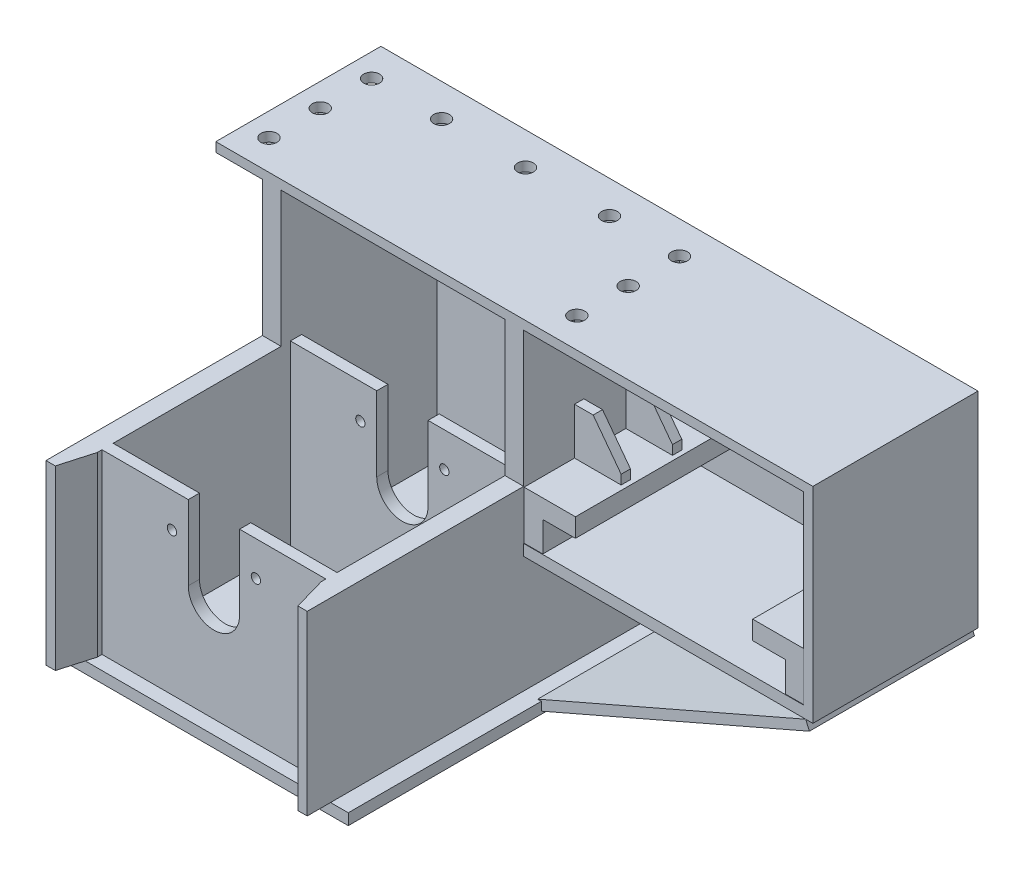
from build123d import *

# Parameters (mm, degrees)
SKETCH_1_W             = 640
SKETCH_1_H             = 177
SKETCH_1_R             = 8.5
EXTRUDE_1_DEPTH        = 10
SKETCH_2_W             = 20
SKETCH_2_H             = 177
EXTRUDE_2_DEPTH        = 335
SKETCH_3_W             = 20
SKETCH_3_H             = 190
EXTRUDE_3_DEPTH        = 232
CUT_EXTRUDE_1_DEPTH    = 764.183464181
SKETCH_5_W             = 240
SKETCH_5_H             = 10
EXTRUDE_4_DEPTH        = 335
SKETCH_6_R             = 35
CUT_EXTRUDE_2_DEPTH    = 10
SKETCH_7_W             = 10
SKETCH_7_H             = 335
EXTRUDE_5_DEPTH        = 300
SKETCH_8_R             = 6
CUT_EXTRUDE_3_DEPTH    = 10
SKETCH_9_W             = 177
SKETCH_9_H             = 210
EXTRUDE_6_DEPTH        = 10
EXTRUDE_7_DEPTH        = 177
SKETCH_12_R            = 5
EXTRUDE_8_DEPTH        = 12
PATTERN_LINEAR_2_COUNT = 2
PATTERN_LINEAR_2_PITCH = 202
SKETCH_14_W            = 300
SKETCH_14_H            = 12
EXTRUDE_9_DEPTH        = 167
SKETCH_15_W            = 166
SKETCH_15_H            = 32
EXTRUDE_10_DEPTH       = 20
SKETCH_16_W            = 55
SKETCH_16_H            = 20
EXTRUDE_11_DEPTH       = 166
EXTRUDE_12_DEPTH       = 166
SKETCH_18_W            = 300
SKETCH_18_H            = 47
SKETCH_18_H_2          = 45
SKETCH_18_H_3          = 54
CUT_EXTRUDE_4_DEPTH    = 50
EXTRUDE_13_DEPTH       = 10
PATTERN_LINEAR_1_COUNT = 2
PATTERN_LINEAR_1_PITCH = 55
SKETCH_21_W            = 313.989613953
SKETCH_21_H            = 384
EXTRUDE_18_DEPTH       = 12
SKETCH_22_W            = 640
SKETCH_22_H            = 409
CUT_EXTRUDE_5_DEPTH    = 769.682639325


with BuildPart() as part:
    # 草图1 → 凸台-拉伸1 (new body)
    with BuildSketch(Plane(origin=(0, 0, 0), x_dir=(1, 0, 0), z_dir=(0, 1, 0))):
        with Locations((320, 88.5)):
            Rectangle(SKETCH_1_W, SKETCH_1_H)
        with Locations(Location((615, 142, 0), (0, 0, 270))):
            Circle(SKETCH_1_R, mode=Mode.SUBTRACT)
        with Locations(Location((615, 87, 0), (0, 0, 270))):
            Circle(SKETCH_1_R, mode=Mode.SUBTRACT)
        with Locations(Location((615, 32, 0), (0, 0, 270))):
            Circle(SKETCH_1_R, mode=Mode.SUBTRACT)
        with Locations(Location((540, 142, 0), (0, 0, 270))):
            Circle(SKETCH_1_R, mode=Mode.SUBTRACT)
        with Locations(Location((450, 142, 0), (0, 0, 270))):
            Circle(SKETCH_1_R, mode=Mode.SUBTRACT)
        with Locations(Location((360, 142, 0), (0, 0, 270))):
            Circle(SKETCH_1_R, mode=Mode.SUBTRACT)
        with Locations(Location((285, 142, 0), (0, 0, 270))):
            Circle(SKETCH_1_R, mode=Mode.SUBTRACT)
        with Locations(Location((285, 32, 0), (0, 0, 270))):
            Circle(SKETCH_1_R, mode=Mode.SUBTRACT)
        with Locations(Location((285, 87, 0), (0, 0, 270))):
            Circle(SKETCH_1_R, mode=Mode.SUBTRACT)
    extrude(amount=EXTRUDE_1_DEPTH)

    # 草图2 → 凸台-拉伸2 (add)
    with BuildSketch(Plane.XZ):
        with Locations((580, -88.5)):
            Rectangle(SKETCH_2_W, SKETCH_2_H)
        with Locations((320, -88.5)):
            Rectangle(SKETCH_2_W, SKETCH_2_H)
    extrude(amount=EXTRUDE_2_DEPTH)

    # 草图3 → 凸台-拉伸3 (add)
    with BuildSketch(Plane.XY):
        with Locations((580, -240)):
            Rectangle(SKETCH_3_W, SKETCH_3_H)
        with Locations((320, -240)):
            Rectangle(SKETCH_3_W, SKETCH_3_H)
    extrude(amount=EXTRUDE_3_DEPTH)

    # 草图4 → 切除-拉伸1 (cut, through all)
    with BuildSketch(Plane.XZ.offset(335)):
        Polygon((330, 232), (320, 232), (330, 197), align=None)
        Polygon((570, 232), (580, 232), (570, 197), align=None)
    extrude(amount=-CUT_EXTRUDE_1_DEPTH, mode=Mode.SUBTRACT)

    # 草图5 → 凸台-拉伸4 (add)
    with BuildSketch(Plane(origin=(0, 0, 0), x_dir=(-1, 0, 0), z_dir=(0, -1, 0))):
        with Locations((-450, 172)):
            Rectangle(SKETCH_5_W, SKETCH_5_H)
    extrude(amount=EXTRUDE_4_DEPTH)

    # 草图6 → 切除-拉伸2 (cut)
    with BuildSketch(Plane(origin=(0, 0, -177), x_dir=(-1, 0, 0), z_dir=(0, 0, -1))):
        with Locations((-450, -225)):
            Circle(SKETCH_6_R)
    extrude(amount=-CUT_EXTRUDE_2_DEPTH, mode=Mode.SUBTRACT)

    # 草图7 → 凸台-拉伸5 (add)
    with BuildSketch(Plane.ZY.offset(-310)):
        with Locations((-172, -167.5)):
            Rectangle(SKETCH_7_W, SKETCH_7_H)
    extrude(amount=EXTRUDE_5_DEPTH)

    # 草图8 → 切除-拉伸3 (cut)
    with BuildSketch(Plane(origin=(0, 0, -177), x_dir=(-1, 0, 0), z_dir=(0, 0, -1))):
        with Locations((-217, -76)):
            Circle(SKETCH_8_R)
        with Locations((-103, -76)):
            Circle(SKETCH_8_R)
        with Locations((-217, -119)):
            Circle(SKETCH_8_R)
        with Locations((-103, -119)):
            Circle(SKETCH_8_R)
        Polygon((-10, -211), (-295, -335), (-10, -335), align=None)
    extrude(amount=-CUT_EXTRUDE_3_DEPTH, mode=Mode.SUBTRACT)

    # 草图9 → 凸台-拉伸6 (add)
    with BuildSketch(Plane.ZY.offset(-10)):
        with Locations((-88.5, -105)):
            Rectangle(SKETCH_9_W, SKETCH_9_H)
    extrude(amount=EXTRUDE_6_DEPTH)

    # 草图12 → 凸台-拉伸8 (add)
    with BuildSketch(Plane.XY.offset(180)):
        with BuildLine():
            Line((330, -335), (570, -335))
            Line((570, -335), (570, -145))
            Line((570, -145), (477.5, -145))
            Line((477.5, -145), (477.5, -225))
            ThreePointArc((477.5, -225), (450, -252.5), (422.5, -225))
            Line((422.5, -225), (422.5, -145))
            Line((422.5, -145), (330, -145))
            Line((330, -145), (330, -335))
        make_face()
        with Locations((405, -182)):
            Circle(SKETCH_12_R, mode=Mode.SUBTRACT)
        with Locations((495, -182)):
            Circle(SKETCH_12_R, mode=Mode.SUBTRACT)
    extrude_8 = extrude(amount=EXTRUDE_8_DEPTH)

    # 阵列(线性)2: 凸台-拉伸8 ×2
    with Locations(*[(0, 0, -i * PATTERN_LINEAR_2_PITCH) for i in range(1, PATTERN_LINEAR_2_COUNT)]):
        add(extrude_8)

    # 草图14 → 凸台-拉伸9 (add)
    with BuildSketch(Plane.XY.offset(-167)):
        with Locations((160, -204)):
            Rectangle(SKETCH_14_W, SKETCH_14_H)
    extrude(amount=EXTRUDE_9_DEPTH)

    # 草图15 → 凸台-拉伸10 (add)
    with BuildSketch(Plane(origin=(10, 0, 0), x_dir=(0, 0, -1), z_dir=(1, 0, 0))):
        with Locations((83.5, -182)):
            Rectangle(SKETCH_15_W, SKETCH_15_H)
    extrude(amount=EXTRUDE_10_DEPTH)

    # 草图16 → 凸台-拉伸11 (add)
    with BuildSketch(Plane.XY.offset(-0.5)):
        Polygon((310, -146), (310, -198), (290, -198), (290, -166), (255, -166), (255, -146), align=None)
        with Locations((37.5, -156)):
            Rectangle(SKETCH_16_W, SKETCH_16_H)
    extrude(amount=-EXTRUDE_11_DEPTH)

    # 草图17 → 凸台-拉伸12 (add)
    with BuildSketch(Plane.XY.offset(-0.5)):
        Polygon((10, -146), (60, -146), (60, -136), (30, -96), (10, -96), align=None)
        Polygon((310, -146), (260, -146), (260, -136), (290, -96), (310, -96), align=None)
    extrude(amount=-EXTRUDE_12_DEPTH)

    # 草图18 → 切除-拉伸4 (cut)
    with BuildSketch(Plane(origin=(0, -96, 0), x_dir=(1, 0, 0), z_dir=(0, 1, 0))):
        with Locations((160, 143)):
            Rectangle(SKETCH_18_W, SKETCH_18_H)
        with Locations((160, 87)):
            Rectangle(SKETCH_18_W, SKETCH_18_H_2)
        with Locations((160, 27.5)):
            Rectangle(SKETCH_18_W, SKETCH_18_H_3)
    extrude(amount=-CUT_EXTRUDE_4_DEPTH, mode=Mode.SUBTRACT)

    # 草图20 → 凸台-拉伸13 (add)
    with BuildSketch(Plane.XY.offset(-54.5)):
        Polygon((590, 0), (640, 0), (640, -30), (610, -50), (590, -50), align=None)
        Polygon((310, 0), (276.666666667, 0), (276.666666667, -30), (290, -50), (310, -50), align=None)
        Polygon((10, 0), (10, -50), (30, -50), (60, -30), (60, 0), align=None)
    extrude_13 = extrude(amount=-EXTRUDE_13_DEPTH)

    # 阵列(线性)1: 凸台-拉伸13 ×2
    with Locations(*[(0, 0, -i * PATTERN_LINEAR_1_PITCH) for i in range(1, PATTERN_LINEAR_1_COUNT)]):
        add(extrude_13)



with BuildPart() as body_2:
    # 草图11 → 凸台-拉伸7 (new body)
    with BuildSketch(Plane(origin=(0, 0, -177), x_dir=(-1, 0, 0), z_dir=(0, 0, -1))):
        Polygon((-7.71078258, -210.003989614), (-295, -335), (-291.010386047, -344.16967723), (-3.71199895, -219.16967723), (-7.697623289, -210.009169677), align=None)
    extrude(amount=-EXTRUDE_7_DEPTH)


with BuildPart() as part_1:
    add(part.part)

    add(body_2.part)  # 凸台-拉伸18 merges body 2
    # 草图21 → 凸台-拉伸18 (add)
    with BuildSketch(Plane(origin=(0, -335, 0), x_dir=(-1, 0, 0), z_dir=(0, -1, 0))):
        with Locations((-448.005193023, -15)):
            Rectangle(SKETCH_21_W, SKETCH_21_H)
    extrude(amount=EXTRUDE_18_DEPTH)

    # 镜向1: part across plane


with BuildPart() as part_2:
    add(part_1.part)
    add(part_1.part.mirror(Plane(origin=(0, 0, 0), x_dir=(0, 0, 1), z_dir=(1, 0, 0))))

    # 草图22 → 切除-拉伸5 (cut, through all)
    with BuildSketch(Plane(origin=(0, 10, 0), x_dir=(1, 0, 0), z_dir=(0, 1, 0))):
        with Locations((320, -27.5)):
            Rectangle(SKETCH_22_W, SKETCH_22_H)
    extrude(amount=-CUT_EXTRUDE_5_DEPTH, mode=Mode.SUBTRACT)


solid = part_2.part
